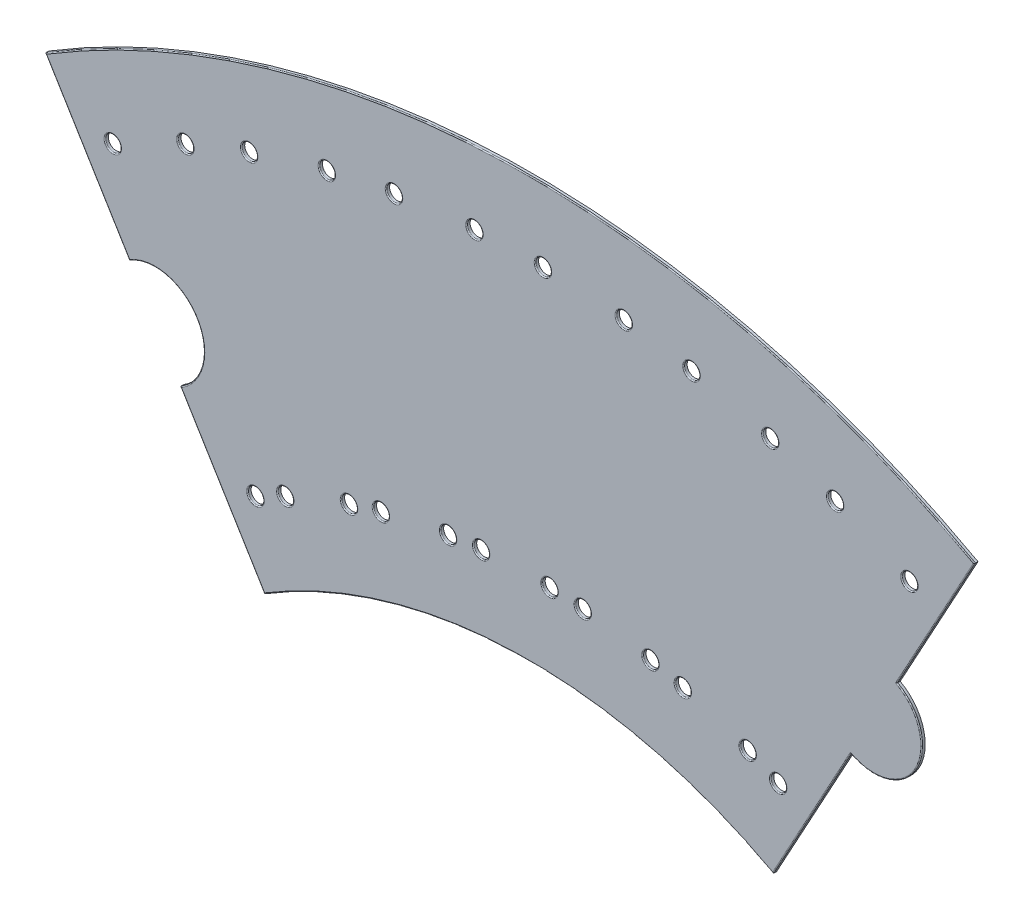
from build123d import *

# Parameters (mm, degrees)
SKETCH1_R           = 1.6
BOSS_EXTRUDE1_DEPTH = 0.7
SKETCH2_R           = 10
CUT_EXTRUDE1_DEPTH  = 215.220009974
SKETCH3_R           = 9.8
BOSS_EXTRUDE2_DEPTH = 0.7
FILLET1_R           = 0.2


with BuildPart() as part:
    # Sketch1 → Boss-Extrude1 (new body)
    # profile 1 of 2: a face of its own
    with BuildSketch(Plane.XY):
        with BuildLine():
            Line((-98.94302741, 162.204430664), (-76.550658049, 125.495006882))
            ThreePointArc((-76.550658049, 125.495006882), (-3.547311106, 146.957193032), (70.406534983, 129.042317988))
            Line((70.406534983, 129.042317988), (91.001643856, 166.789390596))
            ThreePointArc((91.001643856, 166.789390596), (-4.584959933, 189.944671266), (-98.94302741, 162.204430664))
        make_face()
        with Locations((-85.155783064, 153.044087147)):
            Circle(SKETCH1_R, mode=Mode.SUBTRACT)
        with Locations((-70.322566445, 160.401797523)):
            Circle(SKETCH1_R, mode=Mode.SUBTRACT)
        with Locations((-57.286248539, 165.506150122)):
            Circle(SKETCH1_R, mode=Mode.SUBTRACT)
        with Locations((-41.400728813, 170.17631931)):
            Circle(SKETCH1_R, mode=Mode.SUBTRACT)
        with Locations((-27.676100341, 172.939392476)):
            Circle(SKETCH1_R, mode=Mode.SUBTRACT)
        with Locations((-11.220950985, 174.780119748)):
            Circle(SKETCH1_R, mode=Mode.SUBTRACT)
        with Locations((2.774972161, 175.117958901)):
            Circle(SKETCH1_R, mode=Mode.SUBTRACT)
        with Locations((19.299769761, 174.07331469)):
            Circle(SKETCH1_R, mode=Mode.SUBTRACT)
        with Locations((33.141728538, 171.975654758)):
            Circle(SKETCH1_R, mode=Mode.SUBTRACT)
        with Locations((62.501490265, 163.60795737)):
            Circle(SKETCH1_R, mode=Mode.SUBTRACT)
        with Locations((77.672431266, 156.97449927)):
            Circle(SKETCH1_R, mode=Mode.SUBTRACT)
        with Locations((49.234076768, 168.077380051)):
            Circle(SKETCH1_R, mode=Mode.SUBTRACT)
    # profile 2 of 2: a face of its own
    with BuildSketch(Plane.XY):
        with BuildLine():
            ThreePointArc((70.406534983, 129.042317988), (-3.547311106, 146.957193032), (-76.550658049, 125.495006882))
            Line((-76.550658049, 125.495006882), (-54.158288688, 88.7855831))
            ThreePointArc((-54.158288688, 88.7855831), (-2.509662279, 103.969714798), (49.811426111, 91.295245379))
            Line((49.811426111, 91.295245379), (70.406534983, 129.042317988))
        make_face()
        with Locations((-55.993627617, 105.236465478)):
            Circle(SKETCH1_R, mode=Mode.SUBTRACT)
        with Locations((-49.905156048, 108.2565259)):
            Circle(SKETCH1_R, mode=Mode.SUBTRACT)
        with Locations((-36.868838142, 113.360878499)):
            Circle(SKETCH1_R, mode=Mode.SUBTRACT)
        with Locations((-30.348436148, 115.277805424)):
            Circle(SKETCH1_R, mode=Mode.SUBTRACT)
        with Locations((-16.623807677, 118.04087859)):
            Circle(SKETCH1_R, mode=Mode.SUBTRACT)
        with Locations((-9.869594373, 118.796427164)):
            Circle(SKETCH1_R, mode=Mode.SUBTRACT)
        with Locations((10.909130033, 118.705479578)):
            Circle(SKETCH1_R, mode=Mode.SUBTRACT)
        with Locations((24.751088811, 116.607819646)):
            Circle(SKETCH1_R, mode=Mode.SUBTRACT)
        with Locations((31.356386043, 115.007726064)):
            Circle(SKETCH1_R, mode=Mode.SUBTRACT)
        with Locations((44.623799539, 110.538303382)):
            Circle(SKETCH1_R, mode=Mode.SUBTRACT)
        with Locations((4.126328773, 119.134266317)):
            Circle(SKETCH1_R, mode=Mode.SUBTRACT)
        with Locations((50.85089413, 107.815520989)):
            Circle(SKETCH1_R, mode=Mode.SUBTRACT)
    extrude(amount=BOSS_EXTRUDE1_DEPTH)

    # Sketch2 → Cut-Extrude1 (cut, through all)
    with BuildSketch(Plane.XY.offset(0.7)):
        with Locations((-76.550658049, 125.495006882)):
            Circle(SKETCH2_R)
    extrude(amount=-CUT_EXTRUDE1_DEPTH, mode=Mode.SUBTRACT)

    # Sketch3 → Boss-Extrude2 (add)
    with BuildSketch(Plane.XY):
        with Locations((70.406534983, 129.042317988)):
            Circle(SKETCH3_R)
    extrude(amount=BOSS_EXTRUDE2_DEPTH)

    # Fillet1
    fillet1_edges = [part.edges().sort_by_distance(p)[0] for p in [
        (9.309130033, 118.705479578, 0.7),
        (-18.223807677, 118.04087859, 0.7),
        (-31.948436148, 115.277805424, 0.7),
        (-57.593627617, 105.236465478, 0.7),
        (-51.505156048, 108.2565259, 0.7),
        (-38.468838142, 113.360878499, 0.7),
        (-11.469594373, 118.796427164, 0.7),
        (2.526328773, 119.134266317, 0.7),
        (29.756386043, 115.007726064, 0.7),
        (43.023799539, 110.538303382, 0.7),
        (47.634076768, 168.077380051, 0.7),
        (60.901490265, 163.60795737, 0.7),
        (-12.820950985, 174.780119748, 0.7),
        (1.174972161, 175.117958901, 0.7),
        (-71.922566445, 160.401797523, 0.7),
        (-58.886248539, 165.506150122, 0.7),
        (-62.750709489, 102.871757342, 0.7),
        (-2.509662279, 103.969714798, 0.7),
        (57.762096047, 105.867371084, 0.7),
        (-4.584959933, 189.944671266, 0.7),
        (-86.755783064, 153.044087147, 0.7),
        (-29.276100341, 172.939392476, 0.7),
        (-43.000728813, 170.17631931, 0.7),
        (31.541728538, 171.975654758, 0.7),
        (-90.350606609, 148.118256422, 0.7),
        (17.699769761, 174.07331469, 0.7),
        (-68.013582751, 130.70253464, 0.7),
        (76.072431266, 156.97449927, 0.7),
        (49.25089413, 107.815520989, 0.7),
        (83.050973919, 152.217264892, 0.7),
        (79.009356182, 124.348548989, 0.7),
        (23.151088811, 116.607819646, 0.7),
    ]]
    fillet(fillet1_edges, radius=FILLET1_R)


solid = part.part
